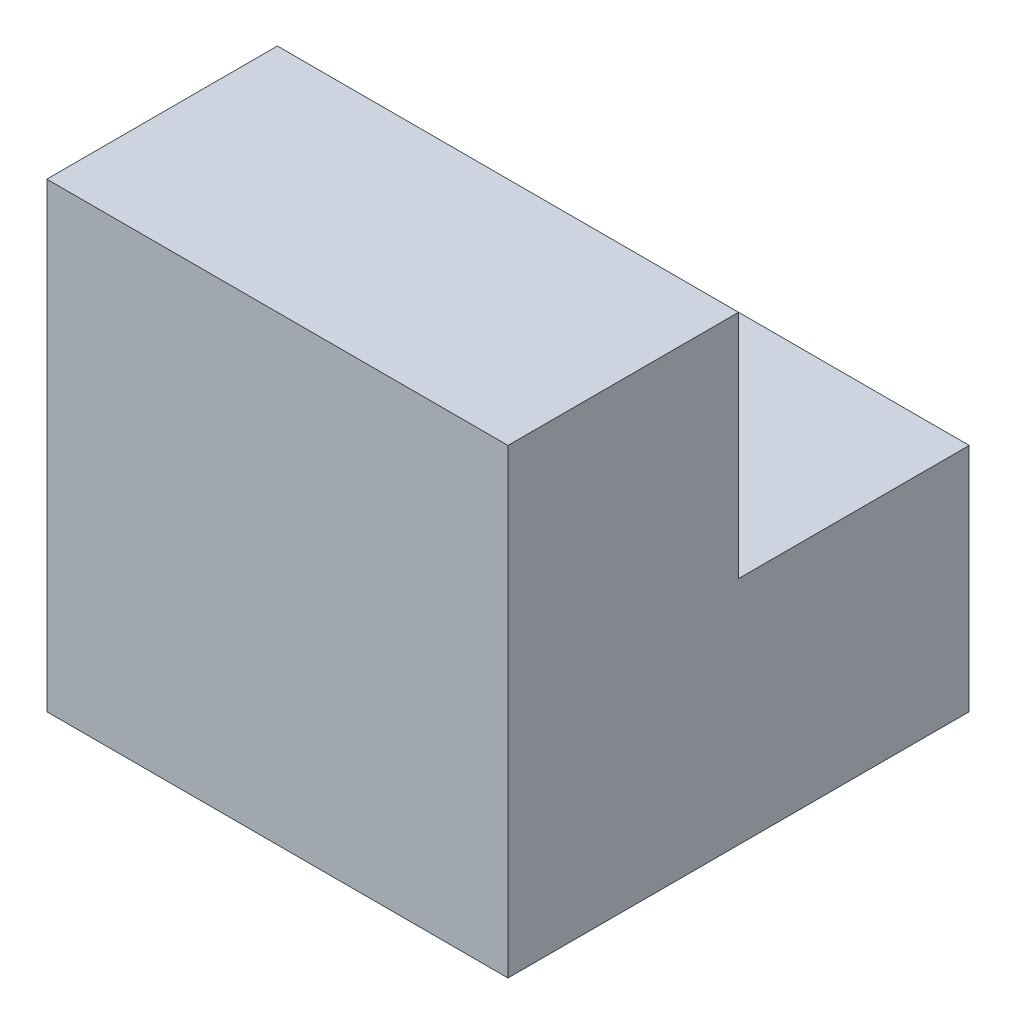
from build123d import *

# Parameters (mm, degrees)
SKETCH1_W           = 50.8
SKETCH1_H           = 50.8
BOSS_EXTRUDE1_DEPTH = 25.4
SKETCH2_W           = 25.4
SKETCH2_H           = 25.4
BOSS_EXTRUDE2_DEPTH = 25.4
SKETCH3_W           = 25.4
SKETCH3_H           = 25.4
BOSS_EXTRUDE3_DEPTH = 25.4


with BuildPart() as part:
    # Sketch1 → Boss-Extrude1 (new body)
    with BuildSketch(Plane(origin=(0, 0, 0), x_dir=(1, 0, 0), z_dir=(0, 1, 0))):
        with Locations((25.4, -25.4)):
            Rectangle(SKETCH1_W, SKETCH1_H)
    extrude(amount=BOSS_EXTRUDE1_DEPTH)

    # Sketch2 → Boss-Extrude2 (add)
    with BuildSketch(Plane(origin=(0, 25.4, 0), x_dir=(1, 0, 0), z_dir=(0, 1, 0))):
        with Locations((38.1, -38.1)):
            Rectangle(SKETCH2_W, SKETCH2_H)
    extrude(amount=BOSS_EXTRUDE2_DEPTH)

    # Sketch3 → Boss-Extrude3 (add)
    with BuildSketch(Plane.ZY.offset(-25.4)):
        with Locations((38.1, 38.1)):
            Rectangle(SKETCH3_W, SKETCH3_H)
    extrude(amount=BOSS_EXTRUDE3_DEPTH)


solid = part.part
